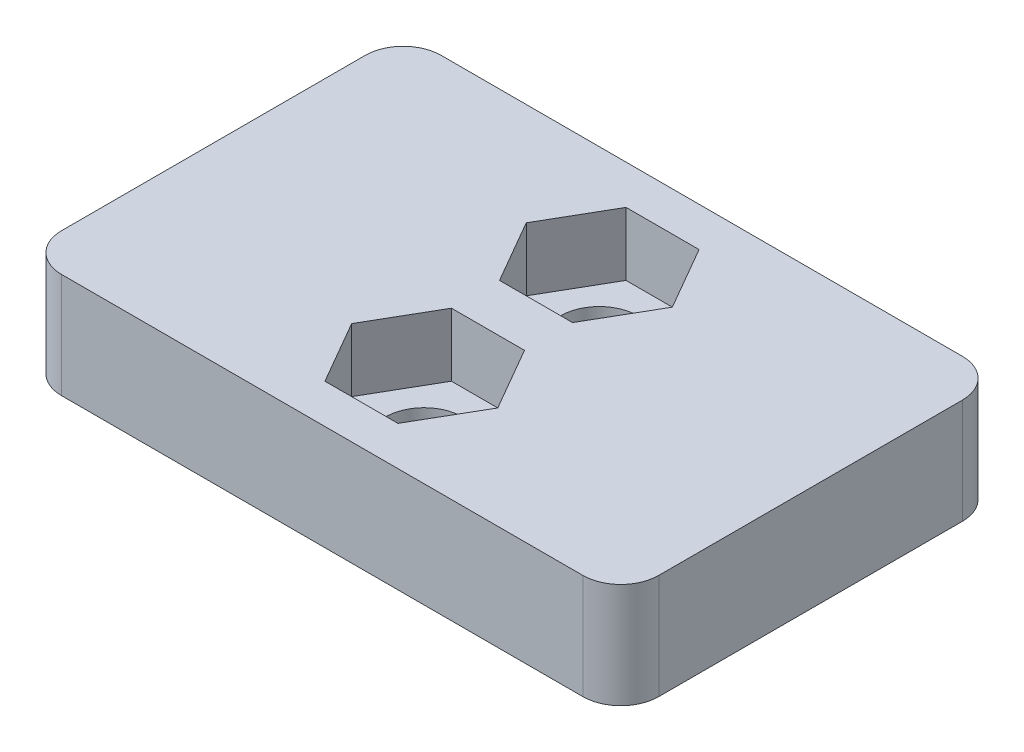
from build123d import *

# Parameters (mm, degrees)
ESQUISSE2_W             = 47.2
ESQUISSE2_H             = 18.3
BOSS_EXTRU_3_DEPTH      = 30
ENL_V_MAT_EXTRU_1_DEPTH = 5
ESQUISSE6_R             = 3.05
ENL_V_MAT_EXTRU_2_DEPTH = 29
CONG_1_R                = 3
ESQUISSE7_W             = 56.209091813
ESQUISSE7_H             = 35.087501562
ENL_V_MAT_EXTRU_3_DEPTH = 10


with BuildPart() as part:
    # Esquisse2 → Boss.-Extru.3 (new body)
    with BuildSketch(Plane.XY):
        with Locations((32.341918096, 14.118251)):
            Rectangle(ESQUISSE2_W, ESQUISSE2_H)
    extrude(amount=BOSS_EXTRU_3_DEPTH)

    # Esquisse3 → Enlèv. mat.-Extru.1 (cut)
    with BuildSketch(Plane(origin=(0, 23.268251, 0), x_dir=(1, 0, 0), z_dir=(0, 1, 0))):
        Polygon((38.115420787, -8.1), (35.228669442, -3.1), (29.45516675, -3.1), (26.568415404, -8.1), (29.45516675, -13.1), (35.228669442, -13.1), align=None)
        Polygon((38.115420787, -21.9), (35.228669442, -16.9), (29.45516675, -16.9), (26.568415404, -21.9), (29.45516675, -26.9), (35.228669442, -26.9), align=None)
    extrude(amount=-ENL_V_MAT_EXTRU_1_DEPTH, mode=Mode.SUBTRACT)

    # Esquisse6 → Enlèv. mat.-Extru.2 (cut)
    with BuildSketch(Plane(origin=(0, 23.268251, 0), x_dir=(1, 0, 0), z_dir=(0, 1, 0))):
        with Locations(Location((32.341903964, -8.100016153, 0), (0, 0, 270))):
            Circle(ESQUISSE6_R)
        with Locations(Location((32.341903964, -21.95, 0), (0, 0, 270))):
            Circle(ESQUISSE6_R)
    extrude(amount=-ENL_V_MAT_EXTRU_2_DEPTH, mode=Mode.SUBTRACT)

    # Congé1
    cong_1_edges = [part.edges().sort_by_distance(p)[0] for p in [
        (55.941918096, 14.118251, 30),
        (8.741918096, 14.118251, 30),
        (55.941918096, 14.118251, 0),
        (8.741918096, 14.118251, 0),
    ]]
    fillet(cong_1_edges, radius=CONG_1_R)

    # Esquisse7 → Enlèv. mat.-Extru.3 (cut)
    with BuildSketch(Plane.XZ.offset(-4.968251)):
        with Locations((35.574310997, 14.252533976)):
            Rectangle(ESQUISSE7_W, ESQUISSE7_H)
    extrude(amount=-ENL_V_MAT_EXTRU_3_DEPTH, mode=Mode.SUBTRACT)


solid = part.part
